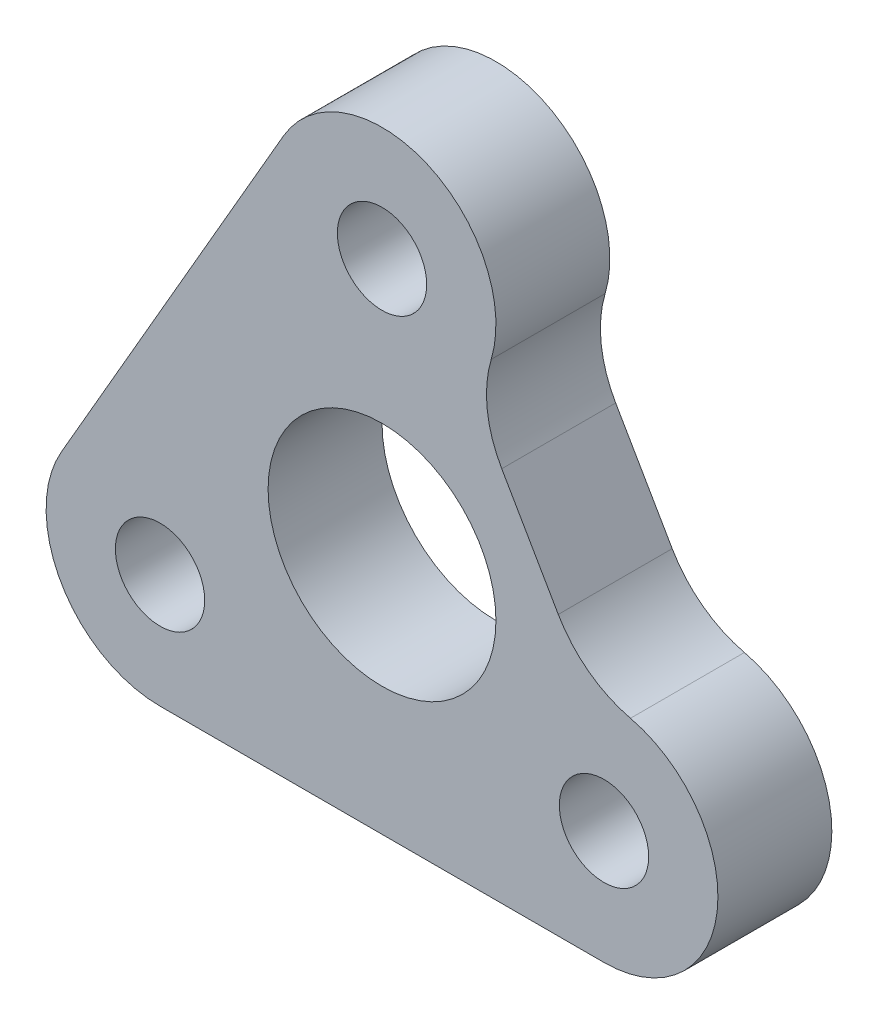
from build123d import *

# Parameters (mm, degrees)
SKETCH1_R           = 6.35
SKETCH1_R_2         = 2.4892
BOSS_EXTRUDE1_DEPTH = 6.35
FILLET1_R           = 6.35
CUT_EXTRUDE1_DEPTH  = 29.579578207
FILLET2_R           = 6.35


with BuildPart() as part:
    # Sketch1 → Boss-Extrude1 (new body)
    with BuildSketch(Plane.XY):
        Polygon((0, 26.9875), (23.371860585, -13.49375), (-23.371860585, -13.49375), align=None)
        Circle(SKETCH1_R, mode=Mode.SUBTRACT)
        with Locations((0, 14.2875)):
            Circle(SKETCH1_R_2, mode=Mode.SUBTRACT)
        with Locations((12.373337957, -7.14375)):
            Circle(SKETCH1_R_2, mode=Mode.SUBTRACT)
        with Locations((-12.373337957, -7.14375)):
            Circle(SKETCH1_R_2, mode=Mode.SUBTRACT)
    extrude(amount=BOSS_EXTRUDE1_DEPTH)

    # Fillet1
    fillet1_edges = [part.edges().sort_by_distance(p)[0] for p in [
        (0, 26.9875, 3.175),
        (23.371860585, -13.49375, 3.175),
        (-23.371860585, -13.49375, 3.175),
    ]]
    fillet(fillet1_edges, radius=FILLET1_R)

    # Sketch2 → Cut-Extrude1 (cut, through all)
    with BuildSketch(Plane.XY.offset(6.35)):
        with BuildLine():
            ThreePointArc((6.35, 14.2875), (6.00448145, 12.221416141), (5.005526767, 10.38017332))
            Line((5.005526767, 10.38017332), (11.492257175, -0.85517332))
            ThreePointArc((11.492257175, -0.85517332), (15.1582056, -1.436998542), (17.872599271, -3.96875))
            Line((17.872599271, -3.96875), (5.499261314, 17.4625))
            ThreePointArc((5.499261314, 17.4625), (6.133628997, 15.931000936), (6.35, 14.2875))
        make_face()
    extrude(amount=-CUT_EXTRUDE1_DEPTH, mode=Mode.SUBTRACT)

    # Fillet2
    fillet2_edges = [part.edges().sort_by_distance(p)[0] for p in [
        (11.492257175, -0.85517332, 3.175),
        (5.005526767, 10.38017332, 3.175),
    ]]
    fillet(fillet2_edges, radius=FILLET2_R)


solid = part.part
